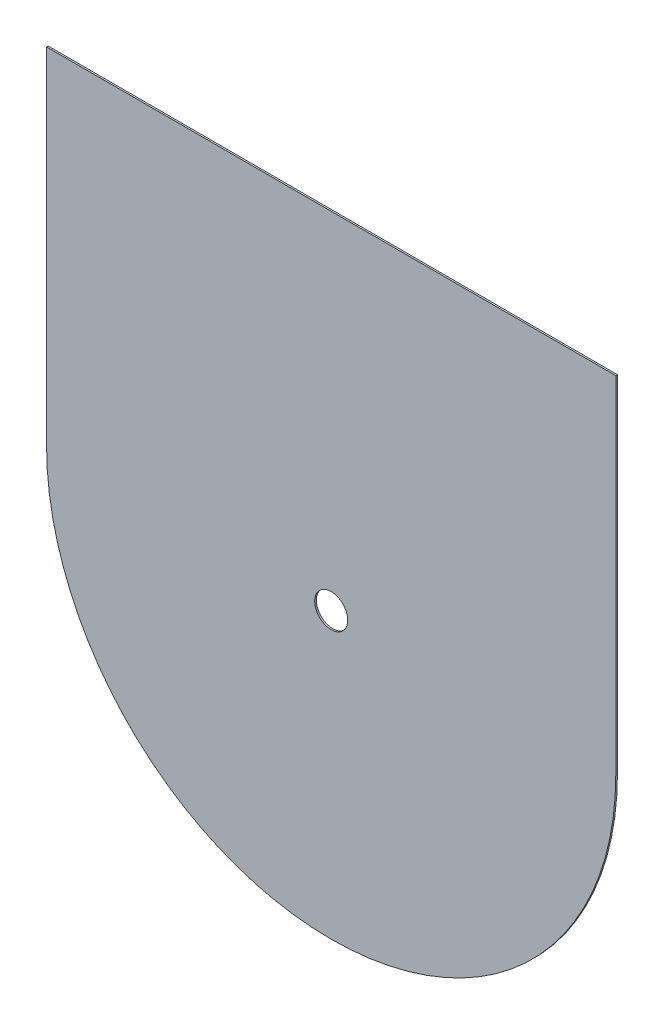
from build123d import *

# Parameters (mm, degrees)
SKETCH1_R           = 20
BOSS_EXTRUDE1_DEPTH = 2


with BuildPart() as part:
    # Sketch1 → Boss-Extrude1 (new body)
    # profile 1 of 2: a face of its own
    with BuildSketch(Plane.XY):
        with BuildLine():
            Line((-375.902130633, 412.038787591), (-375.902130633, -7.061212409))
            ThreePointArc((-375.902130633, -7.061212409), (-31.002130633, -351.961212409), (313.897869367, -7.061212409))
            Line((313.897869367, -7.061212409), (313.897869367, 412.038787591))
            Line((313.897869367, 412.038787591), (311.897869367, 412.038787591))
            Line((311.897869367, 412.038787591), (311.897869367, -7.061212409))
            ThreePointArc((311.897869367, -7.061212409), (-31.002130633, -349.961212409), (-373.902130633, -7.061212409))
            Line((-373.902130633, -7.061212409), (-373.902130633, 412.038787591))
            Line((-373.902130633, 412.038787591), (-375.902130633, 412.038787591))
        make_face()
    # profile 2 of 2: a face of its own
    with BuildSketch(Plane.XY):
        with BuildLine():
            Line((311.897869367, 412.038787591), (-373.902130633, 412.038787591))
            Line((-373.902130633, 412.038787591), (-373.902130633, -7.061212409))
            ThreePointArc((-373.902130633, -7.061212409), (-31.002130633, -349.961212409), (311.897869367, -7.061212409))
            Line((311.897869367, -7.061212409), (311.897869367, 412.038787591))
        make_face()
        with Locations((-31.002130633, -7.061212409)):
            Circle(SKETCH1_R, mode=Mode.SUBTRACT)
    extrude(amount=BOSS_EXTRUDE1_DEPTH)


solid = part.part
